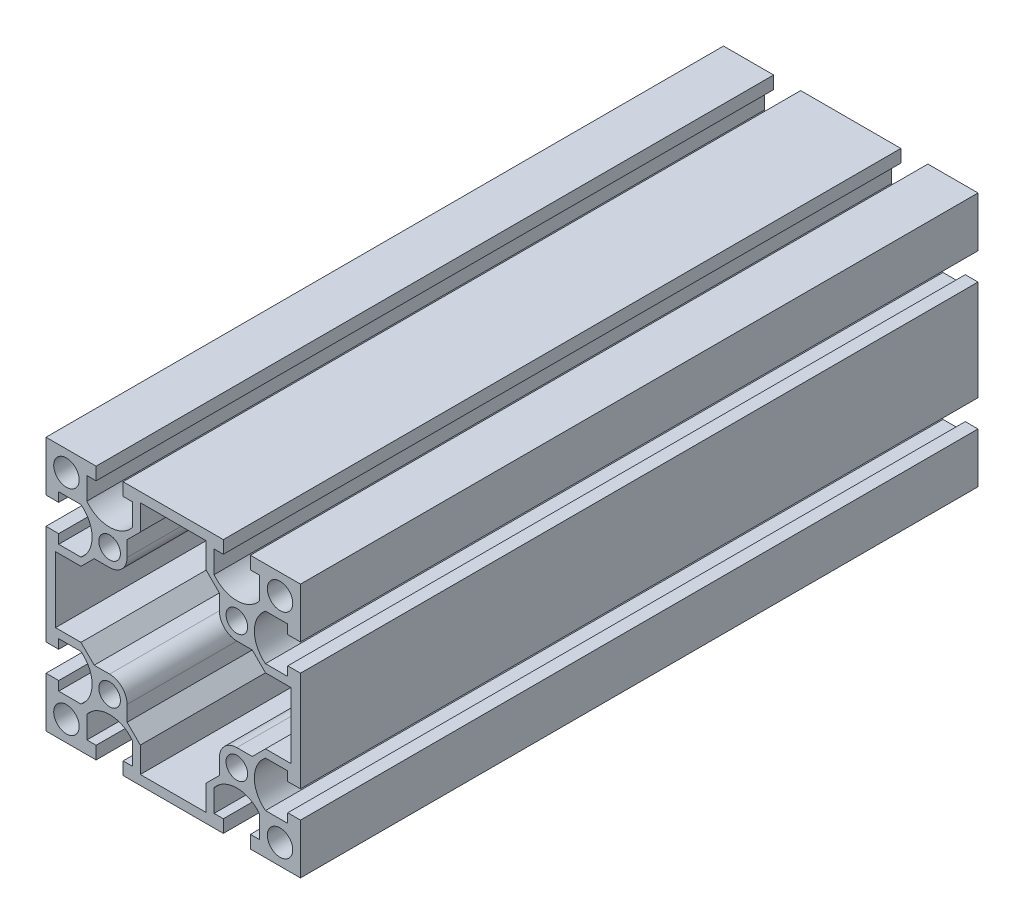
from build123d import *

# Parameters (mm, degrees)
SKETCH_1_R      = 3.4
SKETCH_1_R_2    = 4
EXTRUDE_1_DEPTH = 106.5


with BuildPart() as part:
    # 草图1 → 凸台-拉伸1 (new, symmetric)
    with BuildSketch(Plane.XY):
        with BuildLine():
            Line((-40, 40), (-24.25, 40))
            Line((-24.25, 40), (-24.25, 36))
            Line((-24.25, 36), (-27.15, 36))
            Line((-27.15, 36), (-27.15, 29))
            ThreePointArc((-27.15, 29), (-20, 25.5), (-12.85, 29))
            Line((-12.85, 29), (-12.85, 36))
            Line((-12.85, 36), (-15.75, 36))
            Line((-15.75, 36), (-15.75, 40))
            Line((-15.75, 40), (15.75, 40))
            Line((15.75, 40), (15.75, 36))
            Line((15.75, 36), (12.85, 36))
            Line((12.85, 36), (12.85, 29))
            ThreePointArc((12.85, 29), (20, 25.5), (27.15, 29))
            Line((27.15, 29), (27.15, 36))
            Line((27.15, 36), (24.25, 36))
            Line((24.25, 36), (24.25, 40))
            Line((24.25, 40), (40, 40))
            Line((40, 40), (40, 24.25))
            Line((40, 24.25), (36, 24.25))
            Line((36, 24.25), (36, 27.15))
            Line((36, 27.15), (29, 27.15))
            ThreePointArc((29, 27.15), (25.5, 20), (29, 12.85))
            Line((29, 12.85), (36, 12.85))
            Line((36, 12.85), (36, 15.75))
            Line((36, 15.75), (40.000271684, 15.75))
            Line((40.000271684, 15.75), (40.000271684, -15.75))
            Line((40.000271684, -15.75), (36, -15.75))
            Line((36, -15.75), (36, -12.85))
            Line((36, -12.85), (29, -12.85))
            ThreePointArc((29, -12.85), (25.5, -20), (29, -27.15))
            Line((29, -27.15), (36, -27.15))
            Line((36, -27.15), (36, -24.25))
            Line((36, -24.25), (40, -24.25))
            Line((40, -24.25), (40, -40))
            Line((40, -40), (24.25, -40))
            Line((24.25, -40), (24.25, -36))
            Line((24.25, -36), (27.15, -36))
            Line((27.15, -36), (27.15, -29))
            ThreePointArc((27.15, -29), (20, -25.5), (12.85, -29))
            Line((12.85, -29), (12.85, -36))
            Line((12.85, -36), (15.75, -36))
            Line((15.75, -36), (15.75, -40))
            Line((15.75, -40), (-15.75, -40))
            Line((-15.75, -40), (-15.75, -36))
            Line((-15.75, -36), (-12.85, -36))
            Line((-12.85, -36), (-12.85, -29))
            ThreePointArc((-12.85, -29), (-20, -25.5), (-27.15, -29))
            Line((-27.15, -29), (-27.15, -36))
            Line((-27.15, -36), (-24.25, -36))
            Line((-24.25, -36), (-24.25, -40))
            Line((-24.25, -40), (-40, -40))
            Line((-40, -40), (-40, -24.25))
            Line((-40, -24.25), (-36, -24.25))
            Line((-36, -24.25), (-36, -27.15))
            Line((-36, -27.15), (-29, -27.15))
            ThreePointArc((-29, -27.15), (-25.5, -20), (-29, -12.85))
            Line((-29, -12.85), (-36, -12.85))
            Line((-36, -12.85), (-36, -15.75))
            Line((-36, -15.75), (-40.000271684, -15.75))
            Line((-40.000271684, -15.75), (-40.000271684, 15.75))
            Line((-40.000271684, 15.75), (-36, 15.75))
            Line((-36, 15.75), (-36, 12.85))
            Line((-36, 12.85), (-29, 12.85))
            ThreePointArc((-29, 12.85), (-25.5, 20), (-29, 27.15))
            Line((-29, 27.15), (-36, 27.15))
            Line((-36, 27.15), (-36, 24.25))
            Line((-36, 24.25), (-40, 24.25))
            Line((-40, 24.25), (-40, 40))
        make_face()
        with Locations((-20, 20)):
            Circle(SKETCH_1_R, mode=Mode.SUBTRACT)
        with Locations((-33.575, 33.575)):
            Circle(SKETCH_1_R_2, mode=Mode.SUBTRACT)
        with Locations((33.575, 33.575)):
            Circle(SKETCH_1_R_2, mode=Mode.SUBTRACT)
        with Locations((20, 20)):
            Circle(SKETCH_1_R, mode=Mode.SUBTRACT)
        with Locations((20, -20)):
            Circle(SKETCH_1_R, mode=Mode.SUBTRACT)
        with Locations((33.575, -33.575)):
            Circle(SKETCH_1_R_2, mode=Mode.SUBTRACT)
        with Locations((-33.575, -33.575)):
            Circle(SKETCH_1_R_2, mode=Mode.SUBTRACT)
        with Locations((-20, -20)):
            Circle(SKETCH_1_R, mode=Mode.SUBTRACT)
        with BuildLine():
            Line((10.35, 37), (-10.35, 37))
            Line((-10.35, 37), (-10.35, 29))
            Line((-10.35, 29), (-14.5, 24.85))
            Line((-14.5, 24.85), (-14.5, 20))
            ThreePointArc((-14.5, 20), (-16.110912703, 16.110912703), (-20, 14.5))
            Line((-20, 14.5), (-24.85, 14.5))
            Line((-24.85, 14.5), (-29, 10.35))
            Line((-29, 10.35), (-37, 10.35))
            Line((-37, 10.35), (-37, -10.35))
            Line((-37, -10.35), (-29, -10.35))
            Line((-29, -10.35), (-24.85, -14.5))
            Line((-24.85, -14.5), (-20, -14.5))
            ThreePointArc((-20, -14.5), (-16.110912703, -16.110912703), (-14.5, -20))
            Line((-14.5, -20), (-14.5, -24.85))
            Line((-14.5, -24.85), (-10.35, -29))
            Line((-10.35, -29), (-10.35, -37))
            Line((-10.35, -37), (10.35, -37))
            Line((10.35, -37), (10.35, -29))
            Line((10.35, -29), (14.5, -24.85))
            Line((14.5, -24.85), (14.5, -20))
            ThreePointArc((14.5, -20), (16.110912703, -16.110912703), (20, -14.5))
            Line((20, -14.5), (24.85, -14.5))
            Line((24.85, -14.5), (29, -10.35))
            Line((29, -10.35), (37, -10.35))
            Line((37, -10.35), (37, 10.35))
            Line((37, 10.35), (29, 10.35))
            Line((29, 10.35), (24.85, 14.5))
            Line((24.85, 14.5), (20, 14.5))
            ThreePointArc((20, 14.5), (16.110912703, 16.110912703), (14.5, 20))
            Line((14.5, 20), (14.5, 24.85))
            Line((14.5, 24.85), (10.35, 29))
            Line((10.35, 29), (10.35, 37))
        make_face(mode=Mode.SUBTRACT)
    extrude(amount=EXTRUDE_1_DEPTH, both=True)


solid = part.part
